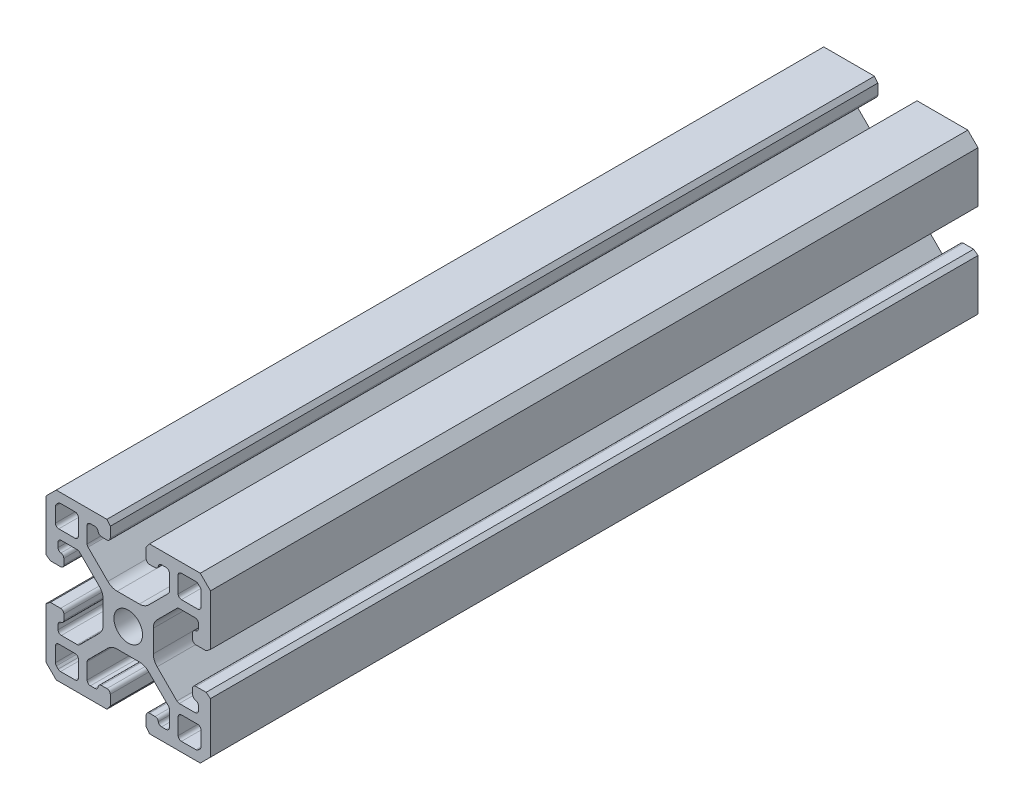
from build123d import *

# Parameters (mm, degrees)
SKETCH1_R           = 3.3147
BOSS_EXTRUDE1_DEPTH = 177.8


with BuildPart() as part:
    # Sketch1 → Boss-Extrude1 (new body)
    with BuildSketch(Plane(origin=(0, 0, 0), x_dir=(-1, 0, 0), z_dir=(0, 0, 1))):
        with BuildLine():
            Line((-19.05, 4.9276), (-19.05, 16.6878))
            Line((-19.05, 16.6878), (-16.6878, 19.05))
            Line((-16.6878, 19.05), (-4.9276, 19.05))
            Line((-4.9276, 19.05), (-4.1656, 18.044024186))
            Line((-4.1656, 18.044024186), (-4.1656, 15.669241304))
            ThreePointArc((-4.1656, 15.669241304), (-4.393507141, 15.125744462), (-4.940898734, 14.90735736))
            Line((-4.940898734, 14.90735736), (-6.223767748, 14.929749922))
            ThreePointArc((-6.223767748, 14.929749922), (-6.718113097, 15.123354458), (-6.966034507, 15.592816933))
            ThreePointArc((-6.966034507, 15.592816933), (-7.218934357, 16.066687743), (-7.7216, 16.256))
            Line((-7.7216, 16.256), (-8.763, 16.256))
            ThreePointArc((-8.763, 16.256), (-9.301815367, 16.032815367), (-9.525, 15.494))
            Line((-9.525, 15.494), (-9.525, 11.816287081))
            ThreePointArc((-9.525, 11.816287081), (-9.466996204, 11.524682306), (-9.301815367, 11.277471714))
            Line((-9.301815367, 11.277471714), (-4.7244731, 6.700129446))
            ThreePointArc((-4.7244731, 6.700129446), (-3.735630732, 6.0394061), (-2.569211631, 5.807390915))
            Line((-2.569211631, 5.807390915), (2.569211631, 5.807390915))
            ThreePointArc((2.569211631, 5.807390915), (3.735630732, 6.0394061), (4.7244731, 6.700129446))
            Line((4.7244731, 6.700129446), (9.301815367, 11.277471714))
            ThreePointArc((9.301815367, 11.277471714), (9.466996204, 11.524682306), (9.525, 11.816287081))
            Line((9.525, 11.816287081), (9.525, 15.494))
            ThreePointArc((9.525, 15.494), (9.301815367, 16.032815367), (8.763, 16.256))
            Line((8.763, 16.256), (7.7216, 16.256))
            ThreePointArc((7.7216, 16.256), (7.218934357, 16.066687743), (6.966034507, 15.592816933))
            ThreePointArc((6.966034507, 15.592816933), (6.718113097, 15.123354458), (6.223767748, 14.929749922))
            Line((6.223767748, 14.929749922), (4.940898734, 14.90735736))
            ThreePointArc((4.940898734, 14.90735736), (4.393507141, 15.125744462), (4.1656, 15.669241304))
            Line((4.1656, 15.669241304), (4.1656, 18.044024186))
            Line((4.1656, 18.044024186), (4.9276, 19.05))
            Line((4.9276, 19.05), (16.6878, 19.05))
            Line((16.6878, 19.05), (19.05, 16.6878))
            Line((19.05, 16.6878), (19.05, 4.9276))
            Line((19.05, 4.9276), (18.044024186, 4.1656))
            Line((18.044024186, 4.1656), (15.669241304, 4.1656))
            ThreePointArc((15.669241304, 4.1656), (15.125744462, 4.393507141), (14.90735736, 4.940898734))
            Line((14.90735736, 4.940898734), (14.929749922, 6.223767748))
            ThreePointArc((14.929749922, 6.223767748), (15.123354458, 6.718113097), (15.592816933, 6.966034507))
            ThreePointArc((15.592816933, 6.966034507), (16.066687743, 7.218934357), (16.256, 7.7216))
            Line((16.256, 7.7216), (16.256, 8.763))
            ThreePointArc((16.256, 8.763), (16.032815367, 9.301815367), (15.494, 9.525))
            Line((15.494, 9.525), (11.816287081, 9.525))
            ThreePointArc((11.816287081, 9.525), (11.524682306, 9.466996204), (11.277471714, 9.301815367))
            Line((11.277471714, 9.301815367), (6.700129446, 4.7244731))
            ThreePointArc((6.700129446, 4.7244731), (6.0394061, 3.735630732), (5.807390915, 2.569211631))
            Line((5.807390915, 2.569211631), (5.807390915, -2.569211631))
            ThreePointArc((5.807390915, -2.569211631), (6.0394061, -3.735630732), (6.700129446, -4.7244731))
            Line((6.700129446, -4.7244731), (11.277471714, -9.301815367))
            ThreePointArc((11.277471714, -9.301815367), (11.524682306, -9.466996204), (11.816287081, -9.525))
            Line((11.816287081, -9.525), (15.494, -9.525))
            ThreePointArc((15.494, -9.525), (16.032815367, -9.301815367), (16.256, -8.763))
            Line((16.256, -8.763), (16.256, -7.7216))
            ThreePointArc((16.256, -7.7216), (16.066687743, -7.218934357), (15.592816933, -6.966034507))
            ThreePointArc((15.592816933, -6.966034507), (15.123354458, -6.718113097), (14.929749922, -6.223767748))
            Line((14.929749922, -6.223767748), (14.90735736, -4.940898734))
            ThreePointArc((14.90735736, -4.940898734), (15.125744462, -4.393507141), (15.669241304, -4.1656))
            Line((15.669241304, -4.1656), (18.044024186, -4.1656))
            Line((18.044024186, -4.1656), (19.05, -4.9276))
            Line((19.05, -4.9276), (19.05, -16.6878))
            Line((19.05, -16.6878), (16.6878, -19.05))
            Line((16.6878, -19.05), (4.940898734, -19.05))
            Line((4.940898734, -19.05), (4.1656, -18.044024186))
            Line((4.1656, -18.044024186), (4.1656, -15.669241304))
            ThreePointArc((4.1656, -15.669241304), (4.393507141, -15.125744462), (4.940898734, -14.90735736))
            Line((4.940898734, -14.90735736), (6.223767748, -14.929749922))
            ThreePointArc((6.223767748, -14.929749922), (6.718113097, -15.123354458), (6.966034507, -15.592816933))
            ThreePointArc((6.966034507, -15.592816933), (7.218934357, -16.066687743), (7.7216, -16.256))
            Line((7.7216, -16.256), (8.763, -16.256))
            ThreePointArc((8.763, -16.256), (9.301815367, -16.032815367), (9.525, -15.494))
            Line((9.525, -15.494), (9.525, -11.816287081))
            ThreePointArc((9.525, -11.816287081), (9.466996204, -11.524682306), (9.301815367, -11.277471714))
            Line((9.301815367, -11.277471714), (4.7244731, -6.700129446))
            ThreePointArc((4.7244731, -6.700129446), (3.735630732, -6.0394061), (2.569211631, -5.807390915))
            Line((2.569211631, -5.807390915), (-2.569211631, -5.807390915))
            ThreePointArc((-2.569211631, -5.807390915), (-3.735630732, -6.0394061), (-4.7244731, -6.700129446))
            Line((-4.7244731, -6.700129446), (-9.301815367, -11.277471714))
            ThreePointArc((-9.301815367, -11.277471714), (-9.466996204, -11.524682306), (-9.525, -11.816287081))
            Line((-9.525, -11.816287081), (-9.525, -15.494))
            ThreePointArc((-9.525, -15.494), (-9.301815367, -16.032815367), (-8.763, -16.256))
            Line((-8.763, -16.256), (-7.7216, -16.256))
            ThreePointArc((-7.7216, -16.256), (-7.218934357, -16.066687743), (-6.966034507, -15.592816933))
            ThreePointArc((-6.966034507, -15.592816933), (-6.718113097, -15.123354458), (-6.223767748, -14.929749922))
            Line((-6.223767748, -14.929749922), (-4.940898734, -14.90735736))
            ThreePointArc((-4.940898734, -14.90735736), (-4.393507141, -15.125744462), (-4.1656, -15.669241304))
            Line((-4.1656, -15.669241304), (-4.1656, -18.044024186))
            Line((-4.1656, -18.044024186), (-4.9276, -19.05))
            Line((-4.9276, -19.05), (-16.6878, -19.05))
            Line((-16.6878, -19.05), (-19.05, -16.6878))
            Line((-19.05, -16.6878), (-19.05, -4.9276))
            Line((-19.05, -4.9276), (-18.044024186, -4.1656))
            Line((-18.044024186, -4.1656), (-15.669241304, -4.1656))
            ThreePointArc((-15.669241304, -4.1656), (-15.125744462, -4.393507141), (-14.90735736, -4.940898734))
            Line((-14.90735736, -4.940898734), (-14.929749922, -6.223767748))
            ThreePointArc((-14.929749922, -6.223767748), (-15.123354458, -6.718113097), (-15.592816933, -6.966034507))
            ThreePointArc((-15.592816933, -6.966034507), (-16.066687743, -7.218934357), (-16.256, -7.7216))
            Line((-16.256, -7.7216), (-16.256, -8.763))
            ThreePointArc((-16.256, -8.763), (-16.032815367, -9.301815367), (-15.494, -9.525))
            Line((-15.494, -9.525), (-11.816287081, -9.525))
            ThreePointArc((-11.816287081, -9.525), (-11.524682306, -9.466996204), (-11.277471714, -9.301815367))
            Line((-11.277471714, -9.301815367), (-6.700129446, -4.7244731))
            ThreePointArc((-6.700129446, -4.7244731), (-6.0394061, -3.735630732), (-5.807390915, -2.569211631))
            Line((-5.807390915, -2.569211631), (-5.807390915, 2.569211631))
            ThreePointArc((-5.807390915, 2.569211631), (-6.0394061, 3.735630732), (-6.700129446, 4.7244731))
            Line((-6.700129446, 4.7244731), (-11.277471714, 9.301815367))
            ThreePointArc((-11.277471714, 9.301815367), (-11.524682306, 9.466996204), (-11.816287081, 9.525))
            Line((-11.816287081, 9.525), (-15.494, 9.525))
            ThreePointArc((-15.494, 9.525), (-16.032815367, 9.301815367), (-16.256, 8.763))
            Line((-16.256, 8.763), (-16.256, 7.7216))
            ThreePointArc((-16.256, 7.7216), (-16.066687743, 7.218934357), (-15.592816933, 6.966034507))
            ThreePointArc((-15.592816933, 6.966034507), (-15.123354458, 6.718113097), (-14.929749922, 6.223767748))
            Line((-14.929749922, 6.223767748), (-14.90735736, 4.940898734))
            ThreePointArc((-14.90735736, 4.940898734), (-15.125744462, 4.393507141), (-15.669241304, 4.1656))
            Line((-15.669241304, 4.1656), (-18.044024186, 4.1656))
            Line((-18.044024186, 4.1656), (-19.05, 4.9276))
        make_face()
        with Locations(Location((0, 0, 0), (0, 0, 180))):
            Circle(SKETCH1_R, mode=Mode.SUBTRACT)
        with BuildLine():
            Line((-16.8656, 12.319), (-16.8656, 15.682887307))
            ThreePointArc((-16.8656, 15.682887307), (-16.807596204, 15.974492082), (-16.642415367, 16.221702674))
            Line((-16.642415367, 16.221702674), (-16.221702674, 16.642415367))
            ThreePointArc((-16.221702674, 16.642415367), (-15.974492082, 16.807596204), (-15.682887307, 16.8656))
            Line((-15.682887307, 16.8656), (-12.319, 16.8656))
            ThreePointArc((-12.319, 16.8656), (-11.780184633, 16.642415367), (-11.557, 16.1036))
            Line((-11.557, 16.1036), (-11.557, 12.319))
            ThreePointArc((-11.557, 12.319), (-11.780184633, 11.780184633), (-12.319, 11.557))
            Line((-12.319, 11.557), (-16.1036, 11.557))
            ThreePointArc((-16.1036, 11.557), (-16.642415367, 11.780184633), (-16.8656, 12.319))
        make_face(mode=Mode.SUBTRACT)
        with BuildLine():
            Line((-16.1036, -11.557), (-12.319, -11.557))
            ThreePointArc((-12.319, -11.557), (-11.780184633, -11.780184633), (-11.557, -12.319))
            Line((-11.557, -12.319), (-11.557, -16.1036))
            ThreePointArc((-11.557, -16.1036), (-11.780184633, -16.642415367), (-12.319, -16.8656))
            Line((-12.319, -16.8656), (-15.682887307, -16.8656))
            ThreePointArc((-15.682887307, -16.8656), (-15.974492082, -16.807596204), (-16.221702674, -16.642415367))
            Line((-16.221702674, -16.642415367), (-16.642415367, -16.221702674))
            ThreePointArc((-16.642415367, -16.221702674), (-16.807596204, -15.974492082), (-16.8656, -15.682887307))
            Line((-16.8656, -15.682887307), (-16.8656, -12.319))
            ThreePointArc((-16.8656, -12.319), (-16.642415367, -11.780184633), (-16.1036, -11.557))
        make_face(mode=Mode.SUBTRACT)
        with BuildLine():
            Line((15.682887307, -16.8656), (12.319, -16.8656))
            ThreePointArc((12.319, -16.8656), (11.780184633, -16.642415367), (11.557, -16.1036))
            Line((11.557, -16.1036), (11.557, -12.319))
            ThreePointArc((11.557, -12.319), (11.780184633, -11.780184633), (12.319, -11.557))
            Line((12.319, -11.557), (16.1036, -11.557))
            ThreePointArc((16.1036, -11.557), (16.642415367, -11.780184633), (16.8656, -12.319))
            Line((16.8656, -12.319), (16.8656, -15.682887307))
            ThreePointArc((16.8656, -15.682887307), (16.807596204, -15.974492082), (16.642415367, -16.221702674))
            Line((16.642415367, -16.221702674), (16.221702674, -16.642415367))
            ThreePointArc((16.221702674, -16.642415367), (15.974492082, -16.807596204), (15.682887307, -16.8656))
        make_face(mode=Mode.SUBTRACT)
        with BuildLine():
            Line((11.557, 12.319), (11.557, 16.1036))
            ThreePointArc((11.557, 16.1036), (11.780184633, 16.642415367), (12.319, 16.8656))
            Line((12.319, 16.8656), (15.682887307, 16.8656))
            ThreePointArc((15.682887307, 16.8656), (15.974492082, 16.807596204), (16.221702674, 16.642415367))
            Line((16.221702674, 16.642415367), (16.642415367, 16.221702674))
            ThreePointArc((16.642415367, 16.221702674), (16.807596204, 15.974492082), (16.8656, 15.682887307))
            Line((16.8656, 15.682887307), (16.8656, 12.319))
            ThreePointArc((16.8656, 12.319), (16.642415367, 11.780184633), (16.1036, 11.557))
            Line((16.1036, 11.557), (12.319, 11.557))
            ThreePointArc((12.319, 11.557), (11.780184633, 11.780184633), (11.557, 12.319))
        make_face(mode=Mode.SUBTRACT)
    extrude(amount=BOSS_EXTRUDE1_DEPTH)


solid = part.part
